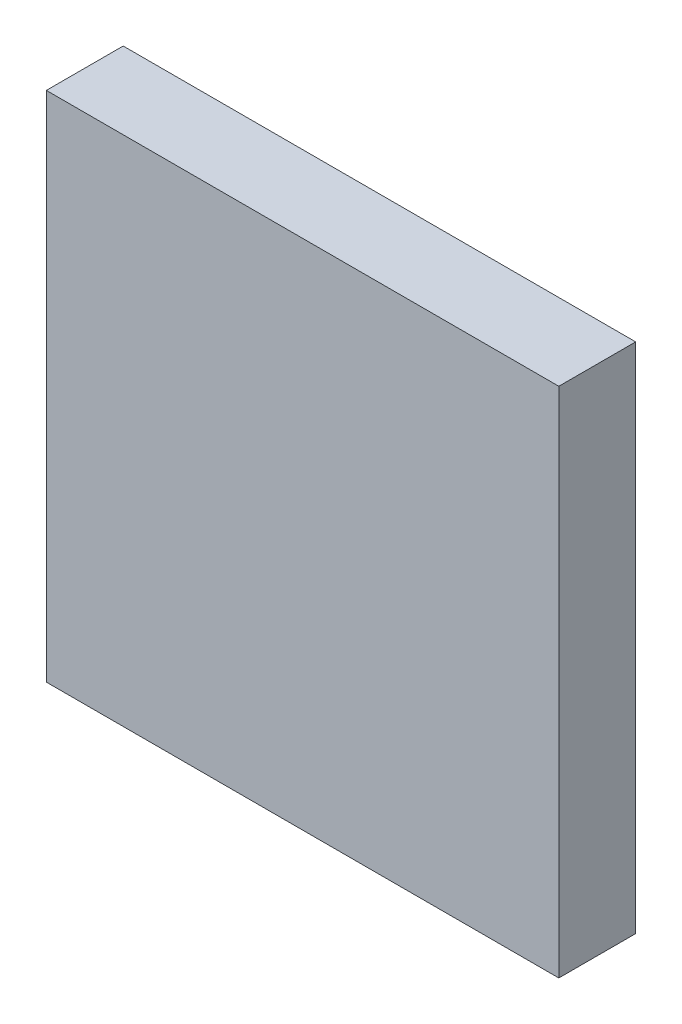
from build123d import *

# Parameters (mm, degrees)
SKETCH_1_W      = 1000
SKETCH_1_H      = 250
EXTRUDE_1_DEPTH = 150
SKETCH_2_W      = 1000
SKETCH_2_H      = 250
EXTRUDE_2_DEPTH = 150
SKETCH_3_W      = 1000
SKETCH_3_H      = 250
EXTRUDE_3_DEPTH = 150
SKETCH_4_W      = 1000
SKETCH_4_H      = 250
EXTRUDE_4_DEPTH = 150


with BuildPart() as part:
    # 草图1 → 凸台-拉伸1 (new body)
    with BuildSketch(Plane.XY):
        Rectangle(SKETCH_1_W, SKETCH_1_H)
    extrude(amount=EXTRUDE_1_DEPTH)

    # 草图2 → 凸台-拉伸2 (add)
    with BuildSketch(Plane.XY):
        with Locations((0, 250)):
            Rectangle(SKETCH_2_W, SKETCH_2_H)
    extrude(amount=EXTRUDE_2_DEPTH)

    # 草图3 → 凸台-拉伸3 (add)
    with BuildSketch(Plane.XY):
        with Locations((0, 500)):
            Rectangle(SKETCH_3_W, SKETCH_3_H)
    extrude(amount=EXTRUDE_3_DEPTH)

    # 草图4 → 凸台-拉伸4 (add)
    with BuildSketch(Plane.XY):
        with Locations((0, 750)):
            Rectangle(SKETCH_4_W, SKETCH_4_H)
    extrude(amount=EXTRUDE_4_DEPTH)


solid = part.part
